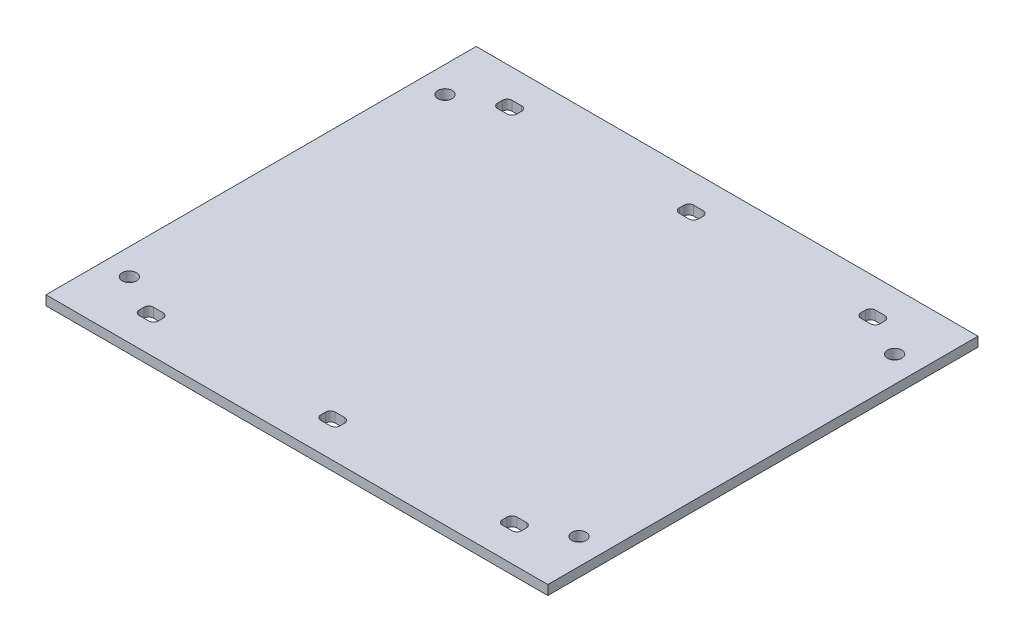
from build123d import *

# Parameters (mm, degrees)
SKETCH1_W                = 105
SKETCH1_H                = 90
BOSS_EXTRUDE1_DEPTH      = 2
M3_CLEARANCE_HOLE1_D     = 3
M3_CLEARANCE_HOLE1_DEPTH = 2
M3_CLEARANCE_HOLE1_TIP   = 0.901290929
SKETCH4_W                = 4
SKETCH4_H                = 3
CUT_EXTRUDE1_DEPTH       = 139.307628134
FILLET1_R                = 1
FILLET2_R                = 1
FILLET3_R                = 1
FILLET4_R                = 1
LPATTERN1_COUNT          = 2
LPATTERN1_PITCH          = 75
LPATTERN1_COUNT_DIR2     = 3
LPATTERN1_PITCH_DIR2     = 38
FILLET1_OF_LPATTERN1_R   = 1
FILLET2_OF_LPATTERN1_R   = 1
FILLET3_OF_LPATTERN1_R   = 1
FILLET4_OF_LPATTERN1_R   = 1


with BuildPart() as part:
    # Sketch1 → Boss-Extrude1 (new body)
    with BuildSketch(Plane(origin=(0, 0, 0), x_dir=(1, 0, 0), z_dir=(0, 1, 0))):
        with Locations((52.5, 45)):
            Rectangle(SKETCH1_W, SKETCH1_H)
    extrude(amount=BOSS_EXTRUDE1_DEPTH)

    # M3 Clearance Hole1
    with Locations(Plane(origin=(0, 2, 0), x_dir=(1, 0, 0), z_dir=(0, 1, 0))):
        with Locations((5.46, 11.98), (5.46, 78.02), (99.54, 78.02), (99.54, 11.98)):
            Hole(M3_CLEARANCE_HOLE1_D / 2, depth=M3_CLEARANCE_HOLE1_DEPTH)
            with Locations((0, 0, -(M3_CLEARANCE_HOLE1_DEPTH + M3_CLEARANCE_HOLE1_TIP / 2))):  # 118° drill point
                Cone(0, M3_CLEARANCE_HOLE1_D / 2, M3_CLEARANCE_HOLE1_TIP, mode=Mode.SUBTRACT)

    # Sketch4 → Cut-Extrude1 (cut, through all)
    with BuildSketch(Plane(origin=(0, 2, 0), x_dir=(1, 0, 0), z_dir=(0, 1, 0))):
        with Locations((14.5, 82.5)):
            Rectangle(SKETCH4_W, SKETCH4_H)
    cut_extrude1 = extrude(amount=-CUT_EXTRUDE1_DEPTH, mode=Mode.SUBTRACT)

    # Fillet1
    fillet1_edges = [part.edges().sort_by_distance(p)[0] for p in [
        (12.5, 1, -84),
    ]]
    fillet(fillet1_edges, radius=FILLET1_R)

    # Fillet2
    fillet2_edges = [part.edges().sort_by_distance(p)[0] for p in [
        (12.5, 1, -81),
    ]]
    fillet(fillet2_edges, radius=FILLET2_R)

    # Fillet3
    fillet3_edges = [part.edges().sort_by_distance(p)[0] for p in [
        (16.5, 1, -84),
    ]]
    fillet(fillet3_edges, radius=FILLET3_R)

    # Fillet4
    fillet4_edges = [part.edges().sort_by_distance(p)[0] for p in [
        (16.5, 1, -81),
    ]]
    fillet(fillet4_edges, radius=FILLET4_R)

    # LPattern1: Cut-Extrude1 2 × 3
    with Locations(*[(j * LPATTERN1_PITCH_DIR2, 0, i * LPATTERN1_PITCH) for i in range(LPATTERN1_COUNT) for j in range(LPATTERN1_COUNT_DIR2) if (i, j) != (0, 0)]):
        add(cut_extrude1, mode=Mode.SUBTRACT)

    # Fillet1 of LPattern1
    fillet1_of_lpattern1_edges = [part.edges().sort_by_distance(p)[0] for p in [
        (50.5, 1, -84),
        (88.5, 1, -84),
        (12.5, 1, -9),
        (50.5, 1, -9),
        (88.5, 1, -9),
    ]]
    fillet(fillet1_of_lpattern1_edges, radius=FILLET1_OF_LPATTERN1_R)

    # Fillet2 of LPattern1
    fillet2_of_lpattern1_edges = [part.edges().sort_by_distance(p)[0] for p in [
        (50.5, 1, -81),
        (88.5, 1, -81),
        (12.5, 1, -6),
        (50.5, 1, -6),
        (88.5, 1, -6),
    ]]
    fillet(fillet2_of_lpattern1_edges, radius=FILLET2_OF_LPATTERN1_R)

    # Fillet3 of LPattern1
    fillet3_of_lpattern1_edges = [part.edges().sort_by_distance(p)[0] for p in [
        (54.5, 1, -84),
        (92.5, 1, -84),
        (16.5, 1, -9),
        (54.5, 1, -9),
        (92.5, 1, -9),
    ]]
    fillet(fillet3_of_lpattern1_edges, radius=FILLET3_OF_LPATTERN1_R)

    # Fillet4 of LPattern1
    fillet4_of_lpattern1_edges = [part.edges().sort_by_distance(p)[0] for p in [
        (54.5, 1, -81),
        (92.5, 1, -81),
        (16.5, 1, -6),
        (54.5, 1, -6),
        (92.5, 1, -6),
    ]]
    fillet(fillet4_of_lpattern1_edges, radius=FILLET4_OF_LPATTERN1_R)


solid = part.part
